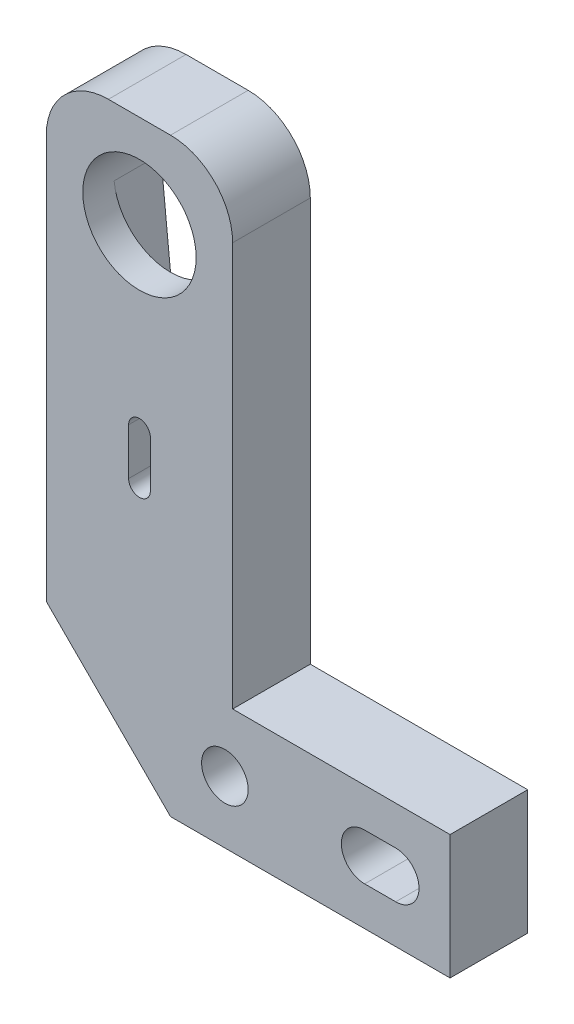
from build123d import *

# Parameters (mm, degrees)
ESBO_O1_R                = 3.65
ESBO_O1_R_2              = 1.5
RESSALTO_EXTRUS_O1_DEPTH = 5
CORTE_EXTRUS_O1_DEPTH    = 3


with BuildPart() as part:
    # Esboço1 → Ressalto-extrusão1 (new body)
    with BuildSketch(Plane.XY):
        with BuildLine():
            ThreePointArc((-2, 6), (-4.828427125, 4.828427125), (-6, 2))
            Line((-6, 2), (-6, -24))
            Line((-6, -24), (2, -32))
            Line((2, -32), (20, -32))
            Line((20, -32), (20, -24))
            Line((20, -24), (6, -24))
            Line((6, -24), (6, 2))
            ThreePointArc((6, 2), (4.828427125, 4.828427125), (2, 6))
            Line((2, 6), (-2, 6))
        make_face()
        Circle(ESBO_O1_R, mode=Mode.SUBTRACT)
        with BuildLine():
            ThreePointArc((0.7, -14.5), (0, -15.2), (-0.7, -14.5))
            Line((-0.7, -14.5), (-0.7, -11.5))
            ThreePointArc((-0.7, -11.5), (0, -10.8), (0.7, -11.5))
            Line((0.7, -11.5), (0.7, -14.5))
        make_face(mode=Mode.SUBTRACT)
        with Locations((5.5, -28)):
            Circle(ESBO_O1_R_2, mode=Mode.SUBTRACT)
        with BuildLine():
            Line((14.5, -26.5), (16.5, -26.5))
            ThreePointArc((16.5, -26.5), (18, -28), (16.5, -29.5))
            Line((16.5, -29.5), (14.5, -29.5))
            ThreePointArc((14.5, -29.5), (13, -28), (14.5, -26.5))
        make_face(mode=Mode.SUBTRACT)
    extrude(amount=RESSALTO_EXTRUS_O1_DEPTH)

    # Esboço1<3> → Corte-extrusão1 (cut)
    with BuildSketch(Plane.XY):
        with BuildLine():
            ThreePointArc((-2.238721733, -14.225), (0, -16.25), (2.238721733, -14.225))
            Line((2.238721733, -14.225), (3.631704145, -0.365))
            ThreePointArc((3.631704145, -0.365), (0, -3.65), (-3.631704145, -0.365))
            Line((-3.631704145, -0.365), (-2.238721733, -14.225))
        make_face()
        with BuildLine():
            ThreePointArc((0.7, -14.5), (0, -15.2), (-0.7, -14.5))
            Line((-0.7, -14.5), (-0.7, -11.5))
            ThreePointArc((-0.7, -11.5), (0, -10.8), (0.7, -11.5))
            Line((0.7, -11.5), (0.7, -14.5))
        make_face(mode=Mode.SUBTRACT)
    extrude(amount=CORTE_EXTRUS_O1_DEPTH, mode=Mode.SUBTRACT)


solid = part.part
